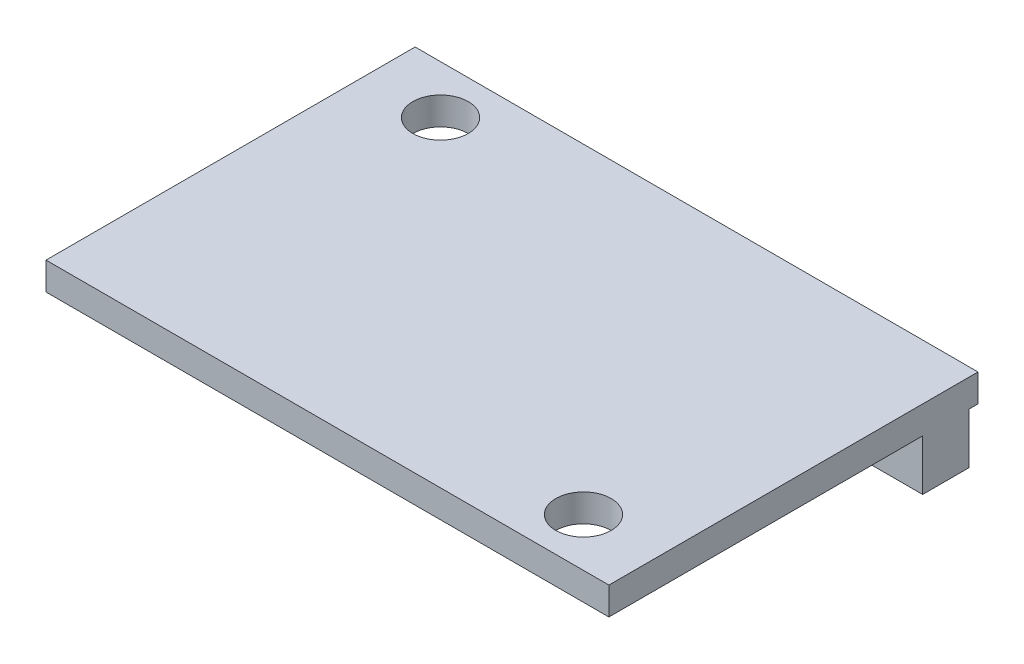
from build123d import *

# Parameters (mm, degrees)
CROQUIS1_W              = 30.5
CROQUIS1_H              = 20
CROQUIS1_R              = 1.5
SALIENTE_EXTRUIR1_DEPTH = 1.5
CROQUIS2_W              = 22
CROQUIS2_H              = 2.5
SALIENTE_EXTRUIR2_DEPTH = 2.75


with BuildPart() as part:
    # Croquis1 → Saliente-Extruir1 (new body)
    with BuildSketch(Plane(origin=(0, 0, 0), x_dir=(1, 0, 0), z_dir=(0, 1, 0))):
        Rectangle(CROQUIS1_W, CROQUIS1_H)
        with Locations(Location((-11.25, 7.37704918, 0), (0, 0, 270))):
            Circle(CROQUIS1_R, mode=Mode.SUBTRACT)
        with Locations(Location((11.25, -7.37704918, 0), (0, 0, 270))):
            Circle(CROQUIS1_R, mode=Mode.SUBTRACT)
    extrude(amount=SALIENTE_EXTRUIR1_DEPTH)

    # Croquis2 → Saliente-Extruir2 (add)
    with BuildSketch(Plane.XZ):
        with Locations((4.25, -8.25)):
            Rectangle(CROQUIS2_W, CROQUIS2_H)
    extrude(amount=SALIENTE_EXTRUIR2_DEPTH)


solid = part.part
